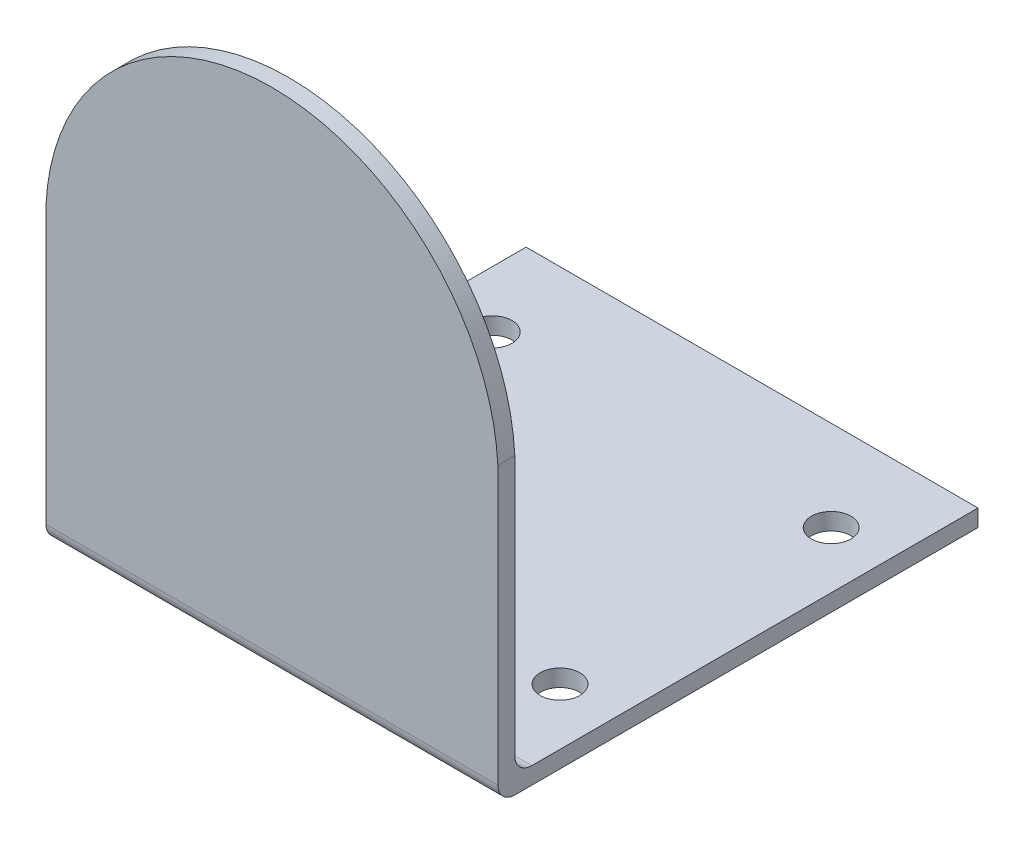
from build123d import *

# Parameters (mm, degrees)
SKETCH_1_W      = 40
SKETCH_1_H      = 41
SKETCH_1_R      = 1.75
EXTRUDE_1_DEPTH = 1.5
EXTRUDE_2_DEPTH = 1.5
FILLET_1_R      = 1.5


with BuildPart() as part:
    # 草图1 → 凸台-拉伸1 (new body)
    with BuildSketch(Plane(origin=(0, 0, 0), x_dir=(1, 0, 0), z_dir=(0, 1, 0))):
        with Locations((-1.409556314, -3.088737201)):
            Rectangle(SKETCH_1_W, SKETCH_1_H)
        with Locations(Location((-16.409556314, 9.411262799, 0), (0, 0, 270))):
            Circle(SKETCH_1_R, mode=Mode.SUBTRACT)
        with Locations(Location((-16.409556314, -14.588737201, 0), (0, 0, 270))):
            Circle(SKETCH_1_R, mode=Mode.SUBTRACT)
        with Locations(Location((13.590443686, 9.411262799, 0), (0, 0, 270))):
            Circle(SKETCH_1_R, mode=Mode.SUBTRACT)
        with Locations(Location((13.590443686, -14.588737201, 0), (0, 0, 270))):
            Circle(SKETCH_1_R, mode=Mode.SUBTRACT)
    extrude(amount=EXTRUDE_1_DEPTH)

    # 草图2 → 凸台-拉伸2 (add)
    with BuildSketch(Plane.XY.offset(23.588737201)):
        with BuildLine():
            Line((-21.409556314, 1.5), (-21.409556314, 26.02333316))
            ThreePointArc((-21.409556314, 26.02333316), (-1.409556314, 45), (18.590443686, 26.02333316))
            Line((18.590443686, 26.02333316), (18.590443686, 1.5))
            Line((18.590443686, 1.5), (18.590443686, 0))
            Line((18.590443686, 0), (-21.409556314, 0))
            Line((-21.409556314, 0), (-21.409556314, 1.5))
        make_face()
    extrude(amount=EXTRUDE_2_DEPTH)

    # 圆角1
    fillet_1_edges = [part.edges().sort_by_distance(p)[0] for p in [
        (-1.409556314, 0, 25.088737201),
        (-1.409556314, 1.5, 23.588737201),
    ]]
    fillet(fillet_1_edges, radius=FILLET_1_R)


solid = part.part
